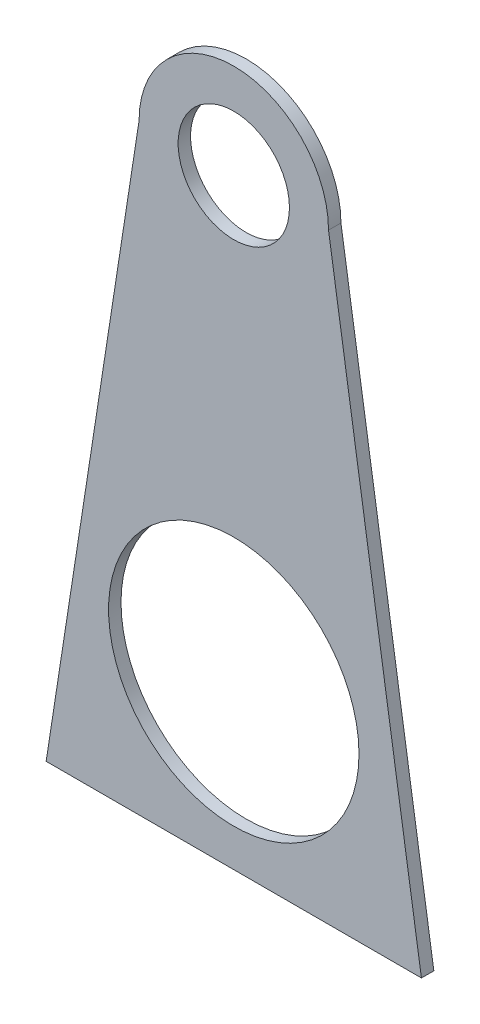
from build123d import *

# Parameters (mm, degrees)
SKETCH1_R           = 14.224
BOSS_EXTRUDE1_DEPTH = 3.175
SKETCH2_R           = 32.004
CUT_EXTRUDE1_DEPTH  = 3.175


with BuildPart() as part:
    # Sketch1 → Boss-Extrude1 (new body)
    with BuildSketch(Plane.XY):
        with BuildLine():
            Line((47.961011706, -153.67), (-47.961011706, -153.67))
            Line((-47.961011706, -153.67), (-24.216066116, 0))
            ThreePointArc((-24.216066116, 0), (0, 24.216066116), (24.216066116, 0))
            Line((24.216066116, 0), (47.961011706, -153.67))
        make_face()
        Circle(SKETCH1_R, mode=Mode.SUBTRACT)
    extrude(amount=BOSS_EXTRUDE1_DEPTH)

    # Sketch2 → Cut-Extrude1 (cut)
    with BuildSketch(Plane.XY.offset(3.175)):
        with Locations((0, -112.056738627)):
            Circle(SKETCH2_R)
    extrude(amount=-CUT_EXTRUDE1_DEPTH, mode=Mode.SUBTRACT)


solid = part.part
